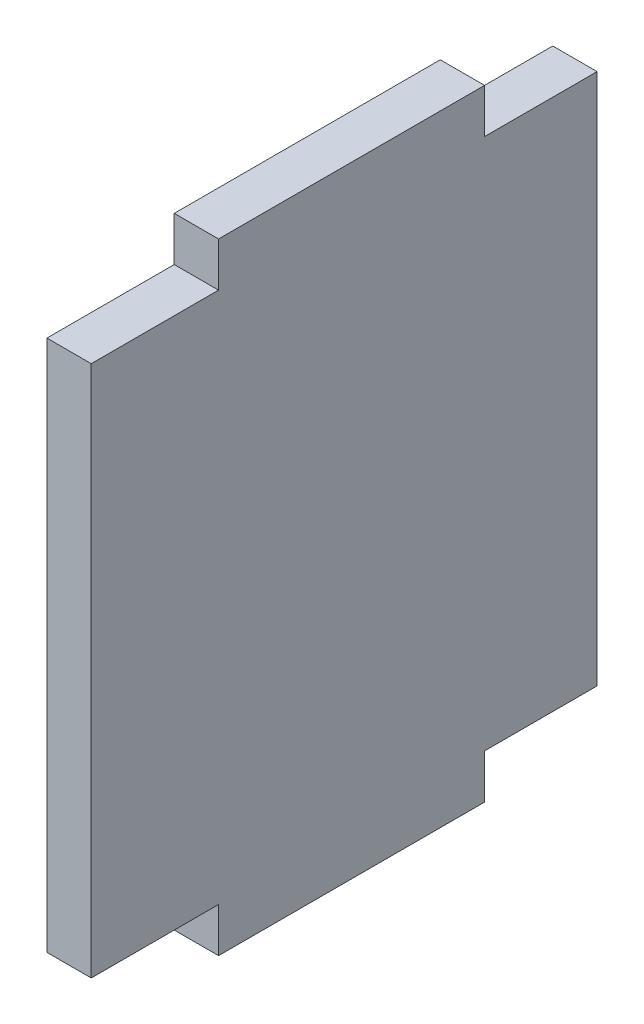
from build123d import *

# Parameters (mm, degrees)
BOSS_EXTRUDE1_DEPTH = 1.25


with BuildPart() as part:
    # Sketch1 → Boss-Extrude1 (new, symmetric)
    with BuildSketch(Plane(origin=(0, 0, 0), x_dir=(0, 0, -1), z_dir=(1, 0, 0))):
        Polygon((13.195, -15), (13.195, 15), (6.85046433, 15), (6.85046433, 17.5), (-8.14953567, 17.5), (-8.14953567, 15), (-15.32953567, 15), (-15.32953567, -15), (-8.14953567, -15), (-8.14953567, -17.5), (6.85046433, -17.5), (6.85046433, -15), align=None)
    extrude(amount=BOSS_EXTRUDE1_DEPTH, both=True)


solid = part.part
